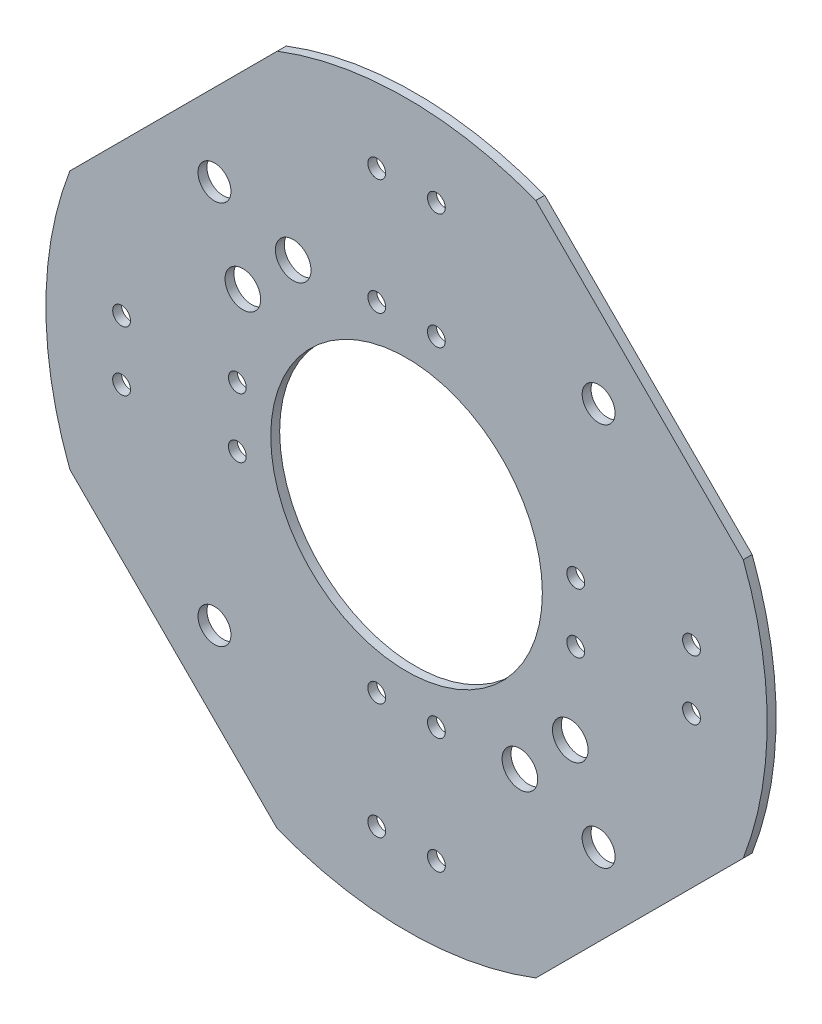
from build123d import *

# Parameters (mm, degrees)
ESQUISSE1_R        = 15.25
ESQUISSE1_R_2      = 1.85
ESQUISSE1_R_3      = 2
ESQUISSE1_R_4      = 1
BOSS_EXTRU_1_DEPTH = 1


with BuildPart() as part:
    # Esquisse1 → Boss.-Extru.1 (new body)
    with BuildSketch(Plane.XY):
        with BuildLine():
            Line((37.808765603, 14.517136205), (14.517136205, 37.808765603))
            ThreePointArc((14.517136205, 37.808765603), (0, 40.5), (-14.517136205, 37.808765603))
            Line((-14.517136205, 37.808765603), (-37.808765603, 14.517136205))
            ThreePointArc((-37.808765603, 14.517136205), (-40.5, 0), (-37.808765603, -14.517136205))
            Line((-37.808765603, -14.517136205), (-14.517136205, -37.808765603))
            ThreePointArc((-14.517136205, -37.808765603), (0, -40.5), (14.517136205, -37.808765603))
            Line((14.517136205, -37.808765603), (37.808765603, -14.517136205))
            ThreePointArc((37.808765603, -14.517136205), (40.5, 0), (37.808765603, 14.517136205))
        make_face()
        Circle(ESQUISSE1_R, mode=Mode.SUBTRACT)
        with Locations((21.566756826, 21.566756826)):
            Circle(ESQUISSE1_R_2, mode=Mode.SUBTRACT)
        with Locations((-21.566756826, -21.566756826)):
            Circle(ESQUISSE1_R_2, mode=Mode.SUBTRACT)
        with Locations((-21.566756826, 21.566756826)):
            Circle(ESQUISSE1_R_2, mode=Mode.SUBTRACT)
        with Locations((21.566756826, -21.566756826)):
            Circle(ESQUISSE1_R_2, mode=Mode.SUBTRACT)
        with Locations((-12.727922061, 18.384776311)):
            Circle(ESQUISSE1_R_3, mode=Mode.SUBTRACT)
        with Locations((-18.384776311, 12.727922061)):
            Circle(ESQUISSE1_R_3, mode=Mode.SUBTRACT)
        with Locations((12.727922061, -18.384776311)):
            Circle(ESQUISSE1_R_3, mode=Mode.SUBTRACT)
        with Locations((18.384776311, -12.727922061)):
            Circle(ESQUISSE1_R_3, mode=Mode.SUBTRACT)
        with Locations((19, -3.35)):
            Circle(ESQUISSE1_R_4, mode=Mode.SUBTRACT)
        with Locations((32, -3.35)):
            Circle(ESQUISSE1_R_4, mode=Mode.SUBTRACT)
        with Locations((32, 3.35)):
            Circle(ESQUISSE1_R_4, mode=Mode.SUBTRACT)
        with Locations((19, 3.35)):
            Circle(ESQUISSE1_R_4, mode=Mode.SUBTRACT)
        with Locations((-19, -3.35)):
            Circle(ESQUISSE1_R_4, mode=Mode.SUBTRACT)
        with Locations((-32, -3.35)):
            Circle(ESQUISSE1_R_4, mode=Mode.SUBTRACT)
        with Locations((-32, 3.35)):
            Circle(ESQUISSE1_R_4, mode=Mode.SUBTRACT)
        with Locations((-19, 3.35)):
            Circle(ESQUISSE1_R_4, mode=Mode.SUBTRACT)
        with Locations((3.35, 19)):
            Circle(ESQUISSE1_R_4, mode=Mode.SUBTRACT)
        with Locations((3.35, 32)):
            Circle(ESQUISSE1_R_4, mode=Mode.SUBTRACT)
        with Locations((-3.35, 32)):
            Circle(ESQUISSE1_R_4, mode=Mode.SUBTRACT)
        with Locations((-3.35, 19)):
            Circle(ESQUISSE1_R_4, mode=Mode.SUBTRACT)
        with Locations((3.35, -19)):
            Circle(ESQUISSE1_R_4, mode=Mode.SUBTRACT)
        with Locations((3.35, -32)):
            Circle(ESQUISSE1_R_4, mode=Mode.SUBTRACT)
        with Locations((-3.35, -32)):
            Circle(ESQUISSE1_R_4, mode=Mode.SUBTRACT)
        with Locations((-3.35, -19)):
            Circle(ESQUISSE1_R_4, mode=Mode.SUBTRACT)
    extrude(amount=BOSS_EXTRU_1_DEPTH)


solid = part.part
